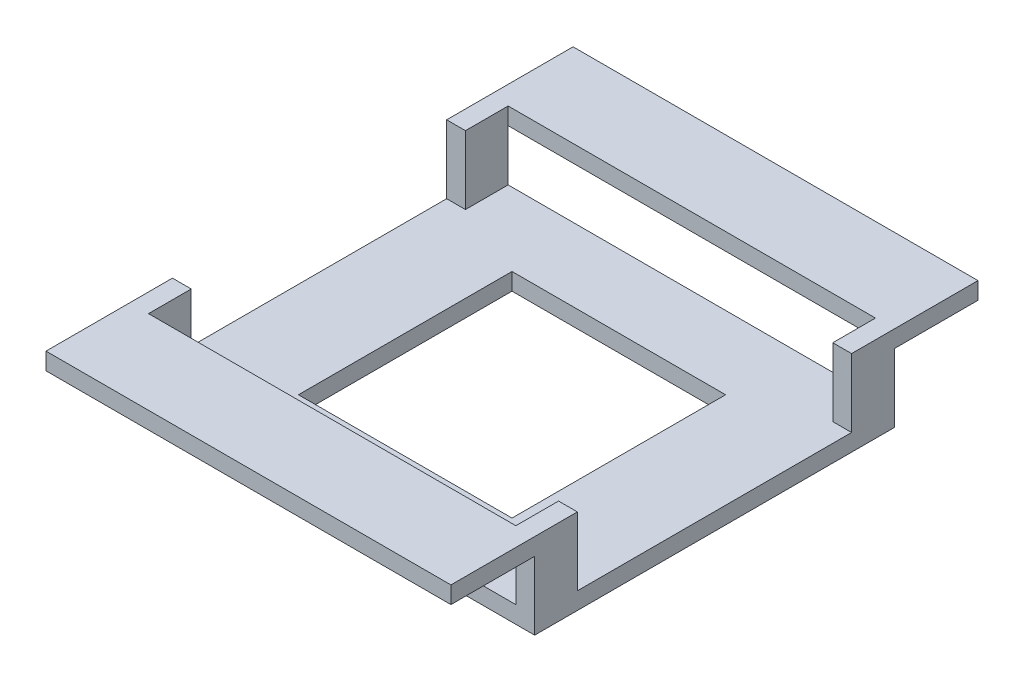
from build123d import *

# Parameters (mm, degrees)
SKETCH3_W               = 47.4
SKETCH3_H               = 42.1
BOSS_EXTRUDE1_DEPTH     = 2
SKETCH4_W               = 2.2
SKETCH4_H               = 5
BOSS_EXTRUDE2_DEPTH     = 8
SKETCH6_W               = 2.2
SKETCH6_H               = 2
BOSS_EXTRUDE3_DEPTH     = 9.8
BOSS_EXTRUDE5_REACH     = 57.631
SKETCH10_W              = 9.8
SKETCH10_H              = 2
MIRROR3_COPY_1_SKETCH_W = 2.2
MIRROR3_COPY_1_SKETCH_H = 5
MIRROR3_COPY_1_DEPTH    = 8
MIRROR3_COPY_2_SKETCH_W = 2.2
MIRROR3_COPY_2_SKETCH_H = 2
MIRROR3_COPY_2_DEPTH    = 9.8
SKETCH7_W               = 25
SKETCH7_H               = 25
CUT_EXTRUDE1_DEPTH      = 2


with BuildPart() as part:
    # Sketch3 → Boss-Extrude1 (new body)
    with BuildSketch(Plane(origin=(0, 0, 0), x_dir=(1, 0, 0), z_dir=(0, 1, 0))):
        Rectangle(SKETCH3_W, SKETCH3_H)
    extrude(amount=BOSS_EXTRUDE1_DEPTH)

    # Sketch4 → Boss-Extrude2 (add)
    with BuildSketch(Plane(origin=(0, 2, 0), x_dir=(1, 0, 0), z_dir=(0, 1, 0))):
        with Locations((-22.6, 18.55)):
            Rectangle(SKETCH4_W, SKETCH4_H)
    boss_extrude2 = extrude(amount=BOSS_EXTRUDE2_DEPTH)

    # Sketch6 → Boss-Extrude3 (add)
    with BuildSketch(Plane(origin=(0, 0, -21.05), x_dir=(-1, 0, 0), z_dir=(0, 0, -1))):
        with Locations((22.6, 9)):
            Rectangle(SKETCH6_W, SKETCH6_H)
    boss_extrude3 = extrude(amount=BOSS_EXTRUDE3_DEPTH)

    # Mirror1: Boss-Extrude2, Boss-Extrude3 across plane
    add(boss_extrude2.mirror(Plane(origin=(0, 0, 0), x_dir=(0, 0, 1), z_dir=(1, 0, 0))))
    add(boss_extrude3.mirror(Plane(origin=(0, 0, 0), x_dir=(0, 0, 1), z_dir=(1, 0, 0))))

    # Sketch10 → Boss-Extrude5 (add, up to next)
    with BuildSketch(Plane(origin=(-21.5, 0, 0), x_dir=(0, 0, -1), z_dir=(1, 0, 0)), mode=Mode.PRIVATE) as boss_extrude5_sk1:
        with Locations((25.95, 9)):
            Rectangle(SKETCH10_W, SKETCH10_H)
    boss_extrude5_tool1 = extrude(boss_extrude5_sk1.sketch, amount=BOSS_EXTRUDE5_REACH, mode=Mode.PRIVATE) - part.part
    boss_extrude5 = boss_extrude5_tool1.solids().sort_by_distance((-21.5, 9, -25.95))[0]
    add(boss_extrude5)

    # Mirror3: Boss-Extrude2, Boss-Extrude3, Boss-Extrude5 across plane
    add(boss_extrude2.mirror(Plane.XY))
    add(boss_extrude3.mirror(Plane.XY))
    add(boss_extrude5.mirror(Plane.XY))

    # Mirror3 copy 1 sketch → Mirror3 copy 1 (add)
    with BuildSketch(Plane(origin=(0, 2, 0), x_dir=(-1, 0, 0), z_dir=(0, 1, 0))):
        with Locations((-22.6, 18.55)):
            Rectangle(MIRROR3_COPY_1_SKETCH_W, MIRROR3_COPY_1_SKETCH_H)
    extrude(amount=MIRROR3_COPY_1_DEPTH)

    # Mirror3 copy 2 sketch → Mirror3 copy 2 (add)
    with BuildSketch(Plane.XY.offset(21.05)):
        with Locations((22.6, 9)):
            Rectangle(MIRROR3_COPY_2_SKETCH_W, MIRROR3_COPY_2_SKETCH_H)
    extrude(amount=MIRROR3_COPY_2_DEPTH)

    # Sketch7 → Cut-Extrude1 (cut)
    with BuildSketch(Plane.XZ):
        Rectangle(SKETCH7_W, SKETCH7_H)
    extrude(amount=-CUT_EXTRUDE1_DEPTH, mode=Mode.SUBTRACT)


solid = part.part
